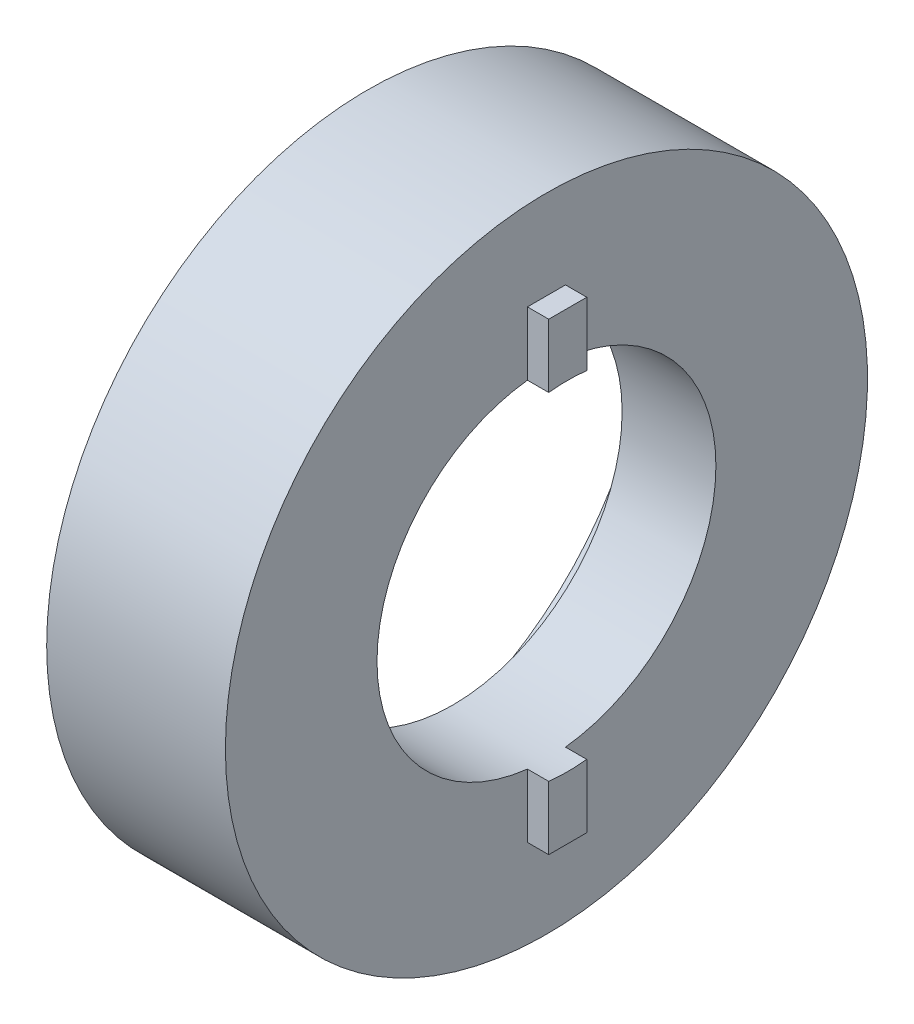
from build123d import *

# Parameters (mm, degrees)
SKETCH13_R           = 36
BOSS_EXTRUDE11_DEPTH = 20.0406
SKETCH14_R           = 31.75
CUT_EXTRUDE2_DEPTH   = 9.525
SKETCH16_W           = 4.2672
SKETCH16_H           = 52
BOSS_EXTRUDE12_DEPTH = 2.3876
SKETCH15_R           = 19
CUT_EXTRUDE3_DEPTH   = 56.632941278


with BuildPart() as part:
    # Sketch13 → Boss-Extrude11 (new body)
    with BuildSketch(Plane(origin=(0, 0, 0), x_dir=(0, 0, -1), z_dir=(1, 0, 0))):
        with Locations(Location((0, 0, 0), (0, 0, 180))):
            Circle(SKETCH13_R)
    extrude(amount=BOSS_EXTRUDE11_DEPTH)

    # Sketch14 → Cut-Extrude2 (cut)
    with BuildSketch(Plane.ZY):
        Circle(SKETCH14_R)
    extrude(amount=-CUT_EXTRUDE2_DEPTH, mode=Mode.SUBTRACT)

    # Sketch16 → Boss-Extrude12 (add)
    with BuildSketch(Plane(origin=(20.0406, 0, 0), x_dir=(0, 0, -1), z_dir=(1, 0, 0))):
        Rectangle(SKETCH16_W, SKETCH16_H)
    extrude(amount=BOSS_EXTRUDE12_DEPTH)

    # Sketch15 → Cut-Extrude3 (cut, through all)
    with BuildSketch(Plane.ZY):
        Circle(SKETCH15_R)
    extrude(amount=-CUT_EXTRUDE3_DEPTH, mode=Mode.SUBTRACT)


solid = part.part
